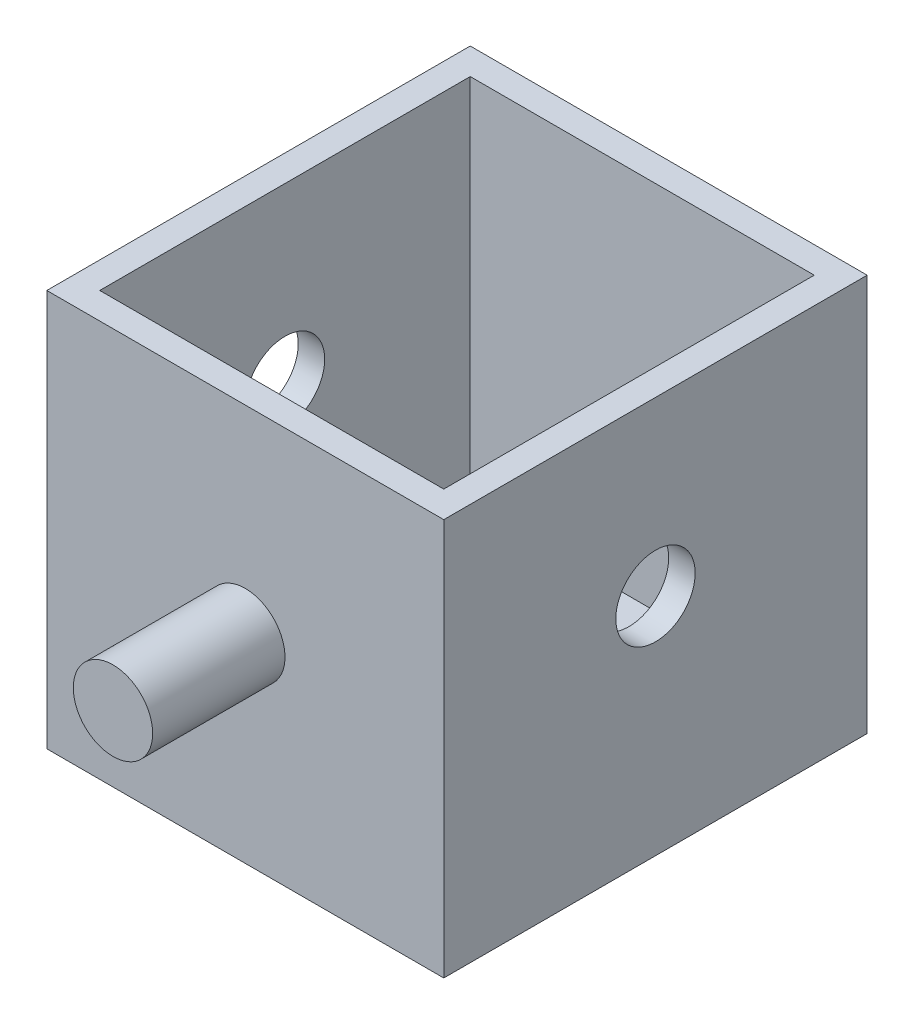
from build123d import *

# Parameters (mm, degrees)
SKETCH1_W          = 38.1
SKETCH1_H          = 38.1
MAIN_BODY_DEPTH    = 40.64
HOLLOW_IT_T        = -2.54
SKETCH3_R          = 3.81
NIBBLE_NO_1_DEPTH  = 12.7
NIBBLE_START       = 12.7
SKETCH4_R          = 3.81
NIBBLE_NO_2_DEPTH  = 12.7
SKETCH5_W          = 1.27
SKETCH5_H          = 3.81
FLAG_DEPTH         = 0.254
SKETCH2_R          = 3.81
NIBBLE_HOLES_DEPTH = 69.261761624


with BuildPart() as part:
    # Sketch1 → main body (new body)
    with BuildSketch(Plane.XY):
        Rectangle(SKETCH1_W, SKETCH1_H)
    extrude(amount=MAIN_BODY_DEPTH)

    # hollow it
    hollow_it_openings = [part.faces().sort_by_distance(p)[0] for p in [
        (0, 19.05, 20.32),
    ]]
    offset(amount=HOLLOW_IT_T, openings=hollow_it_openings, kind=Kind.INTERSECTION)

    # Sketch3 → nibble no 1 (add)
    with BuildSketch(Plane.XY.offset(40.64)):
        with Locations(Location((0, 0, 0), (0, 0, 180))):
            Circle(SKETCH3_R)
    extrude(amount=NIBBLE_NO_1_DEPTH)

    # Sketch4 → nibble no 2 (add)
    with BuildSketch(Plane(origin=(0, 0, 0), x_dir=(-1, 0, 0), z_dir=(0, 0, -1)).offset(NIBBLE_START)):
        Circle(SKETCH4_R)
    extrude(amount=-NIBBLE_NO_2_DEPTH)

    # Sketch5 → flag (add)
    with BuildSketch(Plane(origin=(0, 0, 0), x_dir=(-1, 0, 0), z_dir=(0, -1, 0))):
        with Locations((-0.18666561, 6.353298227)):
            Rectangle(SKETCH5_W, SKETCH5_H)
    extrude(amount=FLAG_DEPTH)

    # Sketch2 → nibble holes (cut, through all)
    with BuildSketch(Plane(origin=(19.05, 0, 0), x_dir=(0, 0, -1), z_dir=(1, 0, 0))):
        with Locations((-20.32, 2.54)):
            Circle(SKETCH2_R)
    extrude(amount=-NIBBLE_HOLES_DEPTH, mode=Mode.SUBTRACT)


solid = part.part
